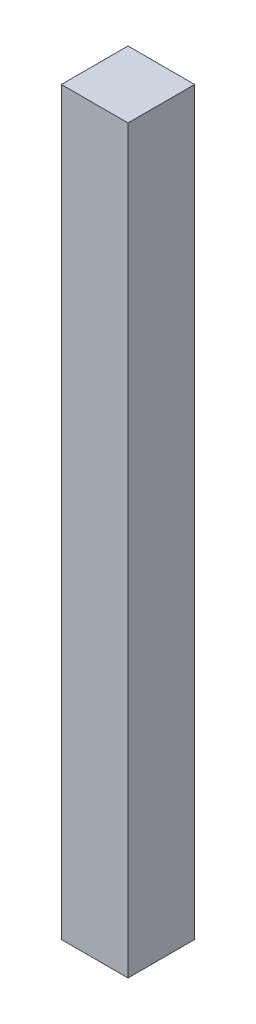
from build123d import *

# Parameters (mm, degrees)
TOPPING_KLAPE_ALT2_GAZLI_AMORTISOR_2_1_START = 8
SKETCH1_W                                    = 18
SKETCH1_H                                    = 200
TOPPING_KLAPE_ALT2_GAZLI_AMORTISOR_2_1_DEPTH = 18


with BuildPart() as part:
    # Sketch1 → TOPPING_klape_alt2_gazli_amortisor_2_1 (new body)
    with BuildSketch(Plane.XY.offset(TOPPING_KLAPE_ALT2_GAZLI_AMORTISOR_2_1_START)):
        with Locations((646, 330)):
            Rectangle(SKETCH1_W, SKETCH1_H)
    extrude(amount=TOPPING_KLAPE_ALT2_GAZLI_AMORTISOR_2_1_DEPTH)


solid = part.part
